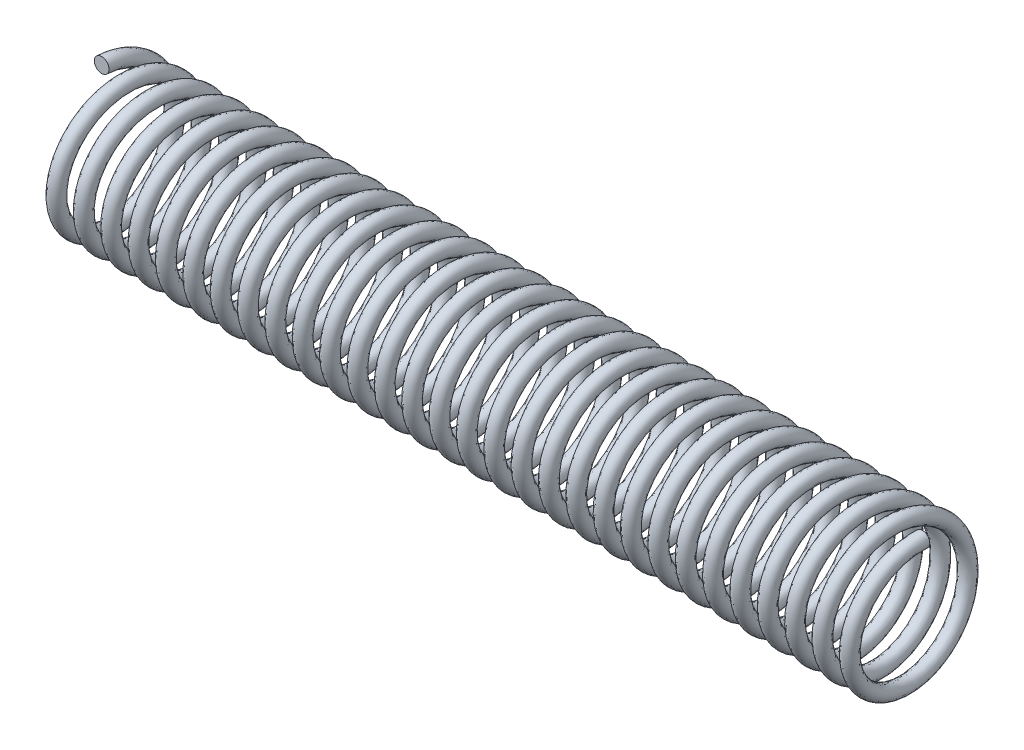
from build123d import *

# Parameters (mm, degrees)
SWEEP1_PITCH       = 1.651
SWEEP1_HEIGHT      = 49.53
SWEEP1_RADIUS      = 3.9624
SWEEP1_START_ANGLE = -90
SKETCH2_R          = 0.4445


with BuildPart() as part:
    # Sweep1: sweep along a helix
    with BuildLine() as sweep1_path:
        add(Helix(SWEEP1_PITCH, SWEEP1_HEIGHT, SWEEP1_RADIUS, center=(0, 0, 0), direction=(1, 0, 0), lefthand=True, mode=Mode.PRIVATE).rotate(Axis((0, 0, 0), (1, 0, 0)), SWEEP1_START_ANGLE))
    # Sketch2 → Sweep1 (sweep)
    with BuildSketch(Plane.XY):
        with Locations((0, 3.9624)):
            Circle(SKETCH2_R)
    sweep(path=sweep1_path.line, is_frenet=True)


solid = part.part
